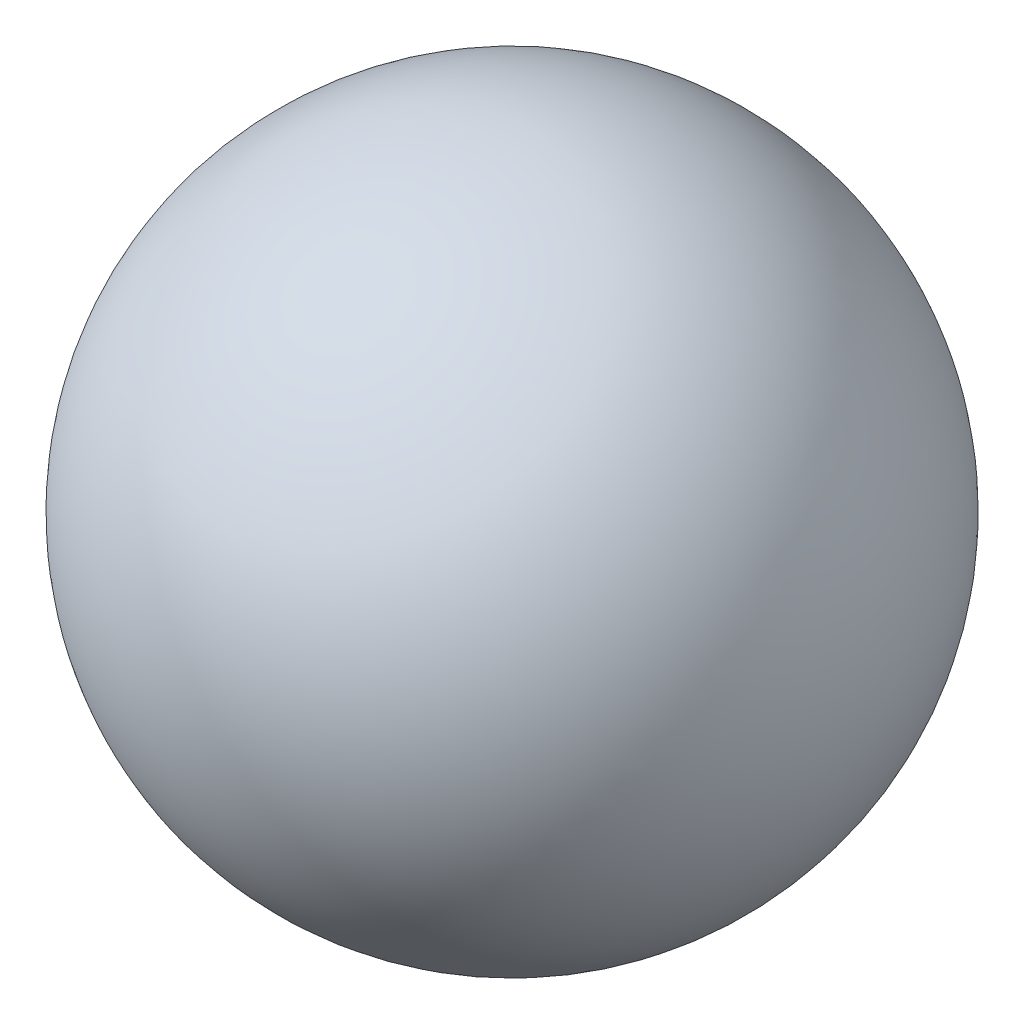
from build123d import *


with BuildPart() as part:
    # Sketch1 → Revolve1 (revolve)
    with BuildSketch(Plane(origin=(0, 0, 0), x_dir=(1, 0, 0), z_dir=(0, 1, 0))):
        with BuildLine():
            Line((0, 95), (0, -95))
            ThreePointArc((0, -95), (95, 0), (0, 95))
        make_face()
    revolve(axis=Axis((0, 0, 95), (0, 0, -1)))


solid = part.part
